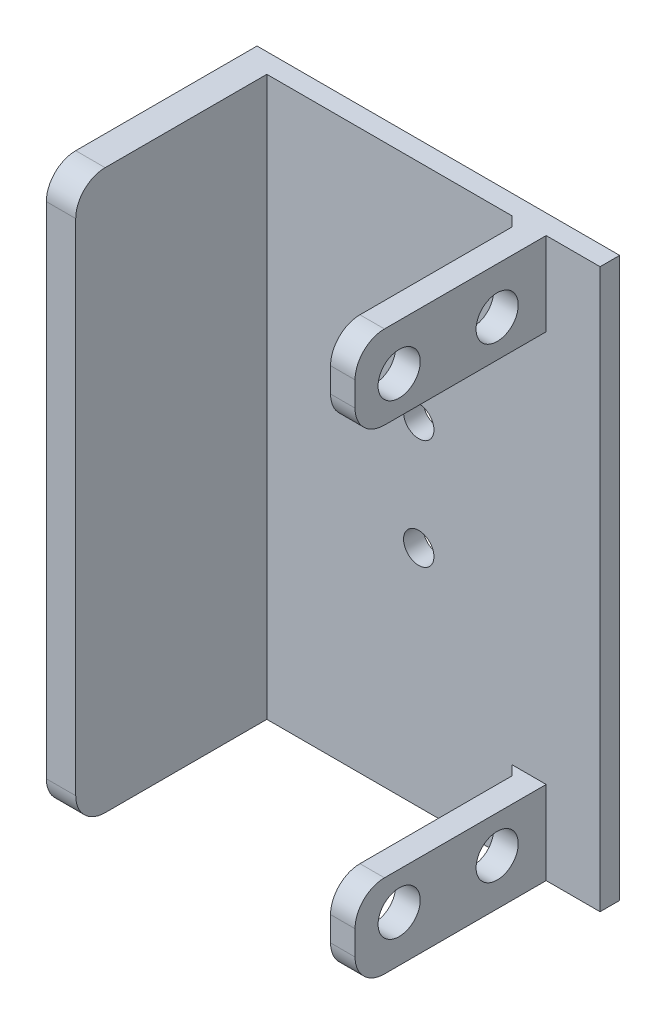
from build123d import *

# Parameters (mm, degrees)
SKETCH_1_W          = 37
SKETCH_1_H          = 57
EXTRUDE_1_DEPTH     = 2
SKETCH_2_W          = 3
SKETCH_2_H          = 57
EXTRUDE_2_DEPTH     = 19.5
SKETCH_3_W          = 2.5
SKETCH_3_H          = 8.5
EXTRUDE_3_DEPTH     = 19.5
SKETCH_4_R          = 1.55
CUT_EXTRUDE_1_DEPTH = 40.17588544
SKETCH_6_R          = 2.5
EXTRUDE_4_DEPTH     = 3
SKETCH_7_R          = 2.15
CUT_EXTRUDE_2_DEPTH = 3
FILLET_1_R          = 3
CHAMFER_2_SIZE      = 1


with BuildPart() as part:
    # 草图1 → 凸台-拉伸1 (new body)
    with BuildSketch(Plane.XY):
        Rectangle(SKETCH_1_W, SKETCH_1_H)
    extrude(amount=EXTRUDE_1_DEPTH)

    # 草图2 → 凸台-拉伸2 (add)
    with BuildSketch(Plane.XY.offset(2)):
        with Locations((-17, 0)):
            Rectangle(SKETCH_2_W, SKETCH_2_H)
    extrude(amount=EXTRUDE_2_DEPTH)

    # 草图3 → 凸台-拉伸3 (add)
    with BuildSketch(Plane.XY.offset(2)):
        with Locations((11.75, -24.25)):
            Rectangle(SKETCH_3_W, SKETCH_3_H)
        with Locations((11.75, 24.25)):
            Rectangle(SKETCH_3_W, SKETCH_3_H)
    extrude(amount=EXTRUDE_3_DEPTH)

    # 草图4 → 切除-拉伸1 (cut, through all)
    with BuildSketch(Plane.XY.offset(2)):
        with Locations((0, 5.6)):
            Circle(SKETCH_4_R)
        with Locations((0, -5.6)):
            Circle(SKETCH_4_R)
    extrude(amount=-CUT_EXTRUDE_1_DEPTH, mode=Mode.SUBTRACT)

    # 草图6 → 凸台-拉伸4 (add)
    with BuildSketch(Plane.ZY.offset(18.5)):
        with Locations(Location((11.5, -9.9, 0), (0, 0, 90))):
            Circle(SKETCH_6_R)
    extrude(amount=EXTRUDE_4_DEPTH)

    # 草图7 → 切除-拉伸2 (cut)
    with BuildSketch(Plane(origin=(13, 0, 0), x_dir=(0, 0, -1), z_dir=(1, 0, 0))):
        with Locations((-17, -23.793044535)):
            Circle(SKETCH_7_R)
        with Locations((-7, -23.793044535)):
            Circle(SKETCH_7_R)
        with Locations(Location((-7, 23.793044535, 0), (0, 0, 90))):
            Circle(SKETCH_7_R)
        with Locations(Location((-17, 23.793044535, 0), (0, 0, 90))):
            Circle(SKETCH_7_R)
    extrude(amount=-CUT_EXTRUDE_2_DEPTH, mode=Mode.SUBTRACT)

    # 圆角1
    fillet_1_edges = [part.edges().sort_by_distance(p)[0] for p in [
        (-17, -28.5, 21.5),
        (-17, 28.5, 21.5),
        (11.75, -28.5, 21.5),
        (11.75, -20, 21.5),
        (11.75, 20, 21.5),
        (11.75, 28.5, 21.5),
    ]]
    fillet(fillet_1_edges, radius=FILLET_1_R)

    # 倒角2
    chamfer_2_edges = [part.edges().sort_by_distance(p)[0] for p in [
        (10.5, -24.25, 2),
        (10.5, 24.25, 2),
    ]]
    chamfer(chamfer_2_edges, length=CHAMFER_2_SIZE)


solid = part.part
